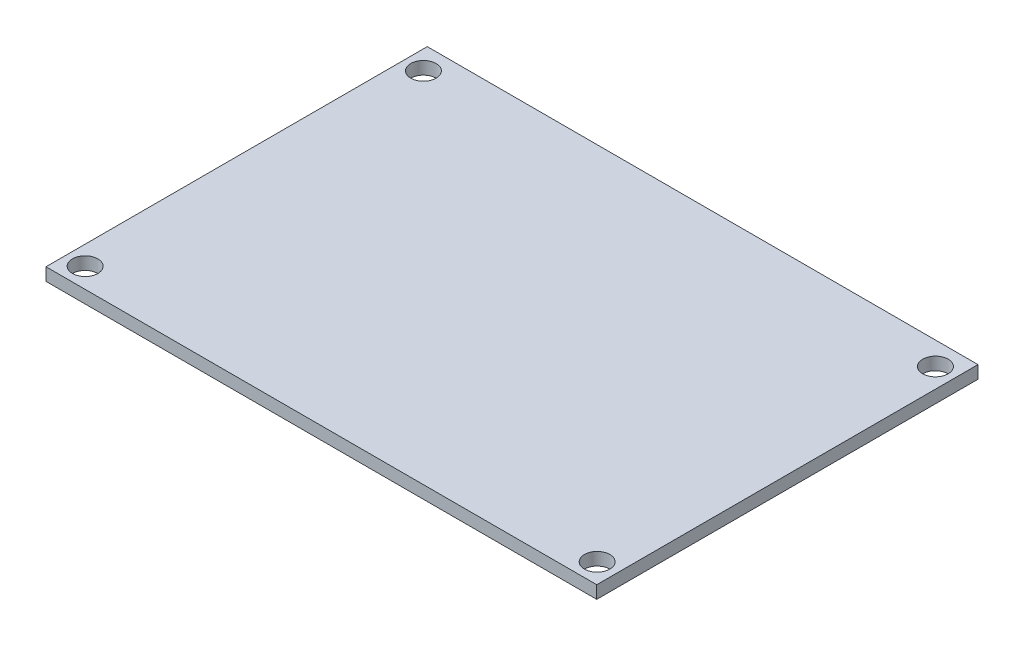
from build123d import *

# Parameters (mm, degrees)
SKETCH1_W           = 65
SKETCH1_H           = 45
BOSS_EXTRUDE1_DEPTH = 1.5
SKETCH2_R           = 1.5
CUT_EXTRUDE1_DEPTH  = 40.556921013


with BuildPart() as part:
    # Sketch1 → Boss-Extrude1 (new body)
    with BuildSketch(Plane(origin=(0, 0, 0), x_dir=(1, 0, 0), z_dir=(0, 1, 0))):
        Rectangle(SKETCH1_W, SKETCH1_H)
    extrude(amount=BOSS_EXTRUDE1_DEPTH)

    # Sketch2 → Cut-Extrude1 (cut, through all)
    with BuildSketch(Plane(origin=(0, 1.5, 0), x_dir=(1, 0, 0), z_dir=(0, 1, 0))):
        with Locations(Location((-30.249814944, 19.794341993, 0), (0, 0, 270))):
            Circle(SKETCH2_R)
        with Locations(Location((30.18214198, 19.794341993, 0), (0, 0, 270))):
            Circle(SKETCH2_R)
        with Locations(Location((30.18214198, -20.132706814, 0), (0, 0, 270))):
            Circle(SKETCH2_R)
        with Locations(Location((-30.249814944, -20.132706814, 0), (0, 0, 270))):
            Circle(SKETCH2_R)
    extrude(amount=-CUT_EXTRUDE1_DEPTH, mode=Mode.SUBTRACT)


solid = part.part
